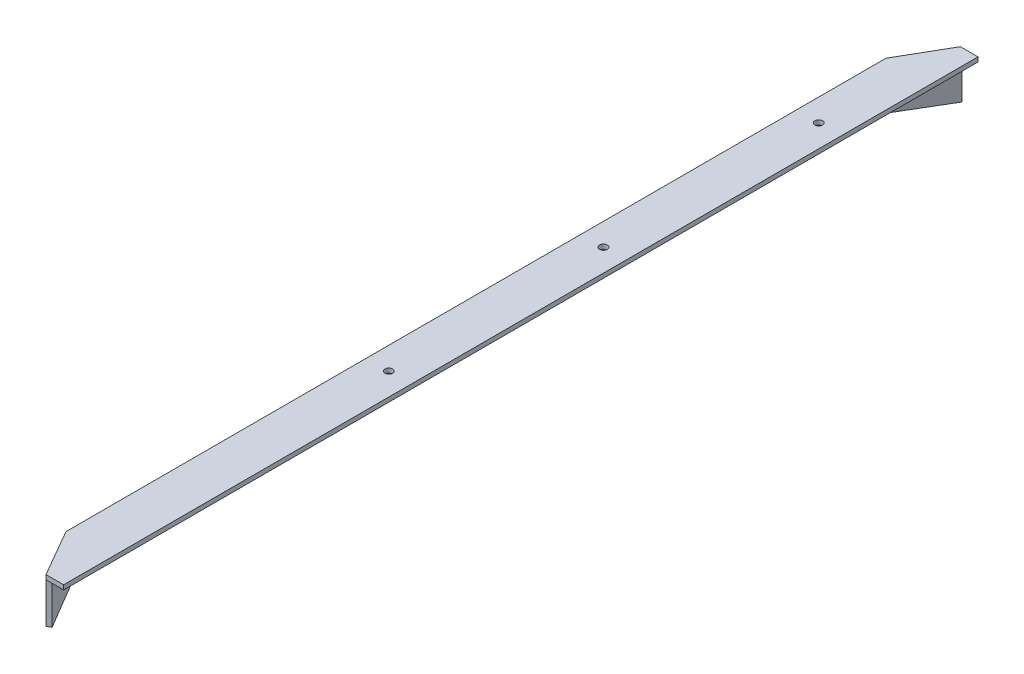
from build123d import *

# Parameters (mm, degrees)
BOSS_EXTRUDE1_DEPTH     = 640
BOSS_EXTRUDE2_DEPTH     = 63
BOSS_EXTRUDE3_DEPTH     = 7
CUT_EXTRUDE6_DEPTH      = 10
CUT_EXTRUDE6_DEPTH_BACK = 10
SKETCH27_R              = 6


with BuildPart() as part:
    # Sketch1 → Boss-Extrude1 (new body)
    with BuildSketch(Plane.XY):
        Polygon((0, 0), (0, 70), (70, 70), (70, 63), (7, 63), (7, 0), align=None)
    extrude(amount=BOSS_EXTRUDE1_DEPTH)

    # Sketch23 → Boss-Extrude2 (add)
    with BuildSketch(Plane(origin=(0, 0, 0), x_dir=(1, 0, 0), z_dir=(0, 1, 0))):
        Polygon((0, -640), (42.5, -713.612159322), (48.562177826, -710.112159322), (7, -640), align=None)
    extrude(amount=BOSS_EXTRUDE2_DEPTH)

    # Sketch25 → Boss-Extrude3 (add)
    with BuildSketch(Plane(origin=(0, 63, 0), x_dir=(1, 0, 0), z_dir=(0, 1, 0))):
        Polygon((70, -640), (0, -640), (42.5, -713.612159322), (70, -713.612159322), align=None)
    extrude(amount=BOSS_EXTRUDE3_DEPTH)

    # Mirror1: part across plane


with BuildPart() as part_1:
    add(part.part)
    add(part.part.mirror(Plane.XY))

    # Sketch27 → Cut-Extrude6 (cut, two sides: drawn at the far end of the back side and taken through both)
    with BuildSketch(Plane(origin=(0, 70, 0), x_dir=(1, 0, 0), z_dir=(0, 1, 0)).offset(-CUT_EXTRUDE6_DEPTH_BACK)):
        with Locations((35, 500)):
            Circle(SKETCH27_R)
        with Locations((35, 164)):
            Circle(SKETCH27_R)
        with Locations((35, -171)):
            Circle(SKETCH27_R)
    extrude(amount=CUT_EXTRUDE6_DEPTH + CUT_EXTRUDE6_DEPTH_BACK, mode=Mode.SUBTRACT)


solid = part_1.part
